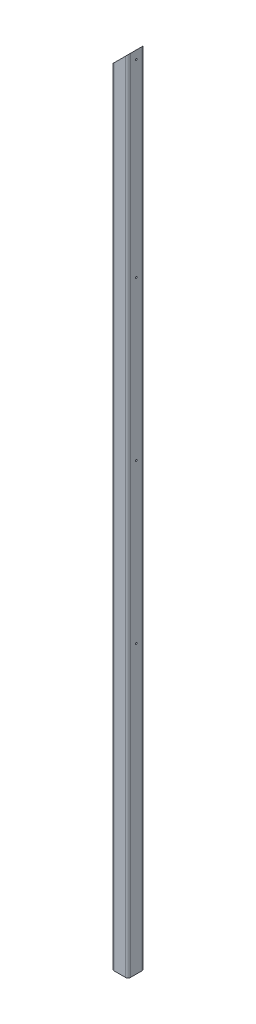
from build123d import *

# Parameters (mm, degrees)
TUBE_SQUARE_40_X_40_X_3_2_1_DEPTH = 1920
CUT_EXTRUDE1_DEPTH                = 1921.52076271
SKETCH16_R                        = 2
CUT_EXTRUDE2_DEPTH                = 3
SKETCH17_R                        = 2
CUT_EXTRUDE3_DEPTH                = 3


with BuildPart() as part:
    # Sketch15 → Tube (square) 40 X 40 X 3.2(1) (new body)
    with BuildSketch(Plane(origin=(0, 0, 0), x_dir=(-1, 0, 0), z_dir=(0, 1, 0))):
        with BuildLine():
            Line((-13.6, -20), (13.6, -20))
            ThreePointArc((13.6, -20), (18.1254834, -18.1254834), (20, -13.6))
            Line((20, -13.6), (20, 13.6))
            ThreePointArc((20, 13.6), (18.1254834, 18.1254834), (13.6, 20))
            Line((13.6, 20), (-13.6, 20))
            ThreePointArc((-13.6, 20), (-18.1254834, 18.1254834), (-20, 13.6))
            Line((-20, 13.6), (-20, -13.6))
            ThreePointArc((-20, -13.6), (-18.1254834, -18.1254834), (-13.6, -20))
        make_face()
        with BuildLine():
            Line((-13.6, -16.8), (13.6, -16.8))
            ThreePointArc((13.6, -16.8), (15.8627417, -15.8627417), (16.8, -13.6))
            Line((16.8, -13.6), (16.8, 13.6))
            ThreePointArc((16.8, 13.6), (15.8627417, 15.8627417), (13.6, 16.8))
            Line((13.6, 16.8), (-13.6, 16.8))
            ThreePointArc((-13.6, 16.8), (-15.8627417, 15.8627417), (-16.8, 13.6))
            Line((-16.8, 13.6), (-16.8, -13.6))
            ThreePointArc((-16.8, -13.6), (-15.8627417, -15.8627417), (-13.6, -16.8))
        make_face(mode=Mode.SUBTRACT)
    extrude(amount=TUBE_SQUARE_40_X_40_X_3_2_1_DEPTH)

    # Sketch13 → Cut-Extrude1 (cut, through all)
    with BuildSketch(Plane(origin=(0, 0, -20), x_dir=(-1, 0, 0), z_dir=(0, 0, -1))):
        Polygon((20, 1880), (-20, 1920), (20, 1920), align=None)
    extrude(amount=-CUT_EXTRUDE1_DEPTH, mode=Mode.SUBTRACT)

    # Sketch16 → Cut-Extrude2 (cut)
    with BuildSketch(Plane(origin=(20, 0, 0), x_dir=(0, 0, -1), z_dir=(1, 0, 0))):
        with Locations((0, 1900)):
            Circle(SKETCH16_R)
        with Locations((0, 1447)):
            Circle(SKETCH16_R)
        with Locations((0, 1067)):
            Circle(SKETCH16_R)
        with Locations((0, 687)):
            Circle(SKETCH16_R)
    extrude(amount=-CUT_EXTRUDE2_DEPTH, mode=Mode.SUBTRACT)

    # Sketch17 → Cut-Extrude3 (cut)
    with BuildSketch(Plane(origin=(0, 0, -20), x_dir=(-1, 0, 0), z_dir=(0, 0, -1))):
        with Locations((0, 687)):
            Circle(SKETCH17_R)
    extrude(amount=-CUT_EXTRUDE3_DEPTH, mode=Mode.SUBTRACT)


solid = part.part
